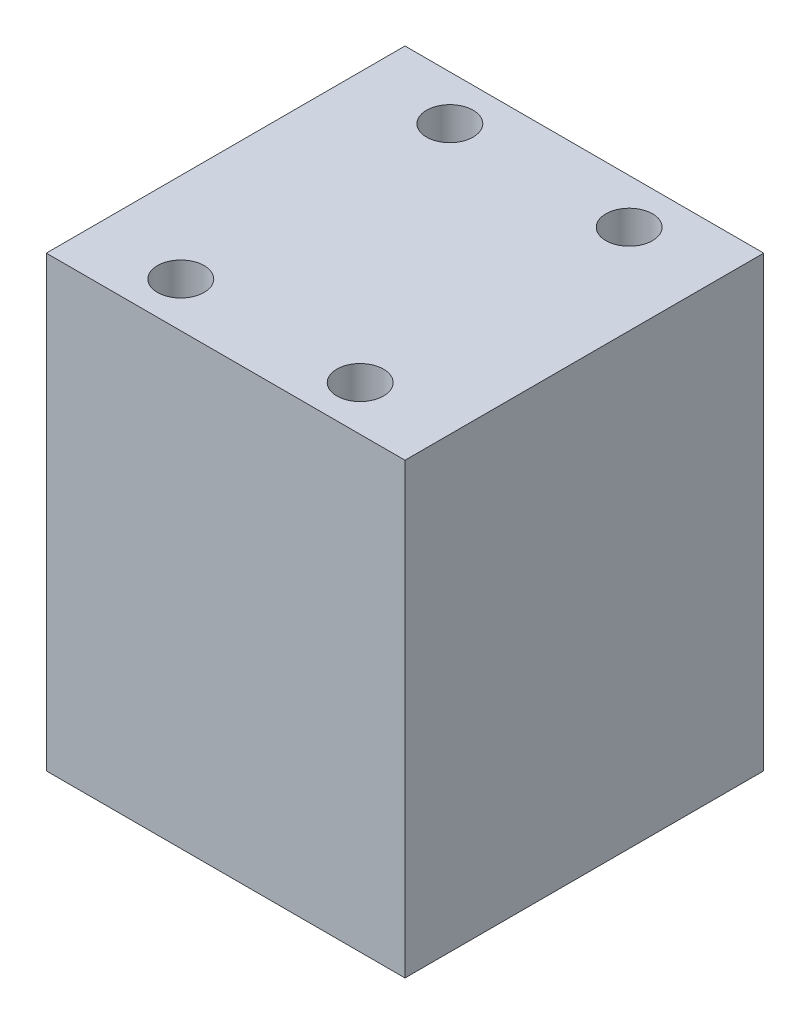
from build123d import *

# Parameters (mm, degrees)
SKETCH_1_W          = 40
SKETCH_1_H          = 40
EXTRUDE_2_DEPTH     = 50
SKETCH_2_R          = 2.6
CUT_EXTRUDE_1_DEPTH = 58.445626465


with BuildPart() as part:
    # 草图1 → 凸台-拉伸2 (new body)
    with BuildSketch(Plane(origin=(0, 0, 0), x_dir=(1, 0, 0), z_dir=(0, 1, 0))):
        Rectangle(SKETCH_1_W, SKETCH_1_H)
    extrude(amount=EXTRUDE_2_DEPTH)

    # 草图2 → 切除-拉伸1 (cut, through all)
    with BuildSketch(Plane(origin=(0, 50, 0), x_dir=(1, 0, 0), z_dir=(0, 1, 0))):
        with Locations(Location((10, 15, 0), (0, 0, 270))):
            Circle(SKETCH_2_R)
        with Locations(Location((-10, 15, 0), (0, 0, 270))):
            Circle(SKETCH_2_R)
        with Locations(Location((-10, -15, 0), (0, 0, 270))):
            Circle(SKETCH_2_R)
        with Locations(Location((10, -15, 0), (0, 0, 270))):
            Circle(SKETCH_2_R)
    extrude(amount=-CUT_EXTRUDE_1_DEPTH, mode=Mode.SUBTRACT)


solid = part.part
